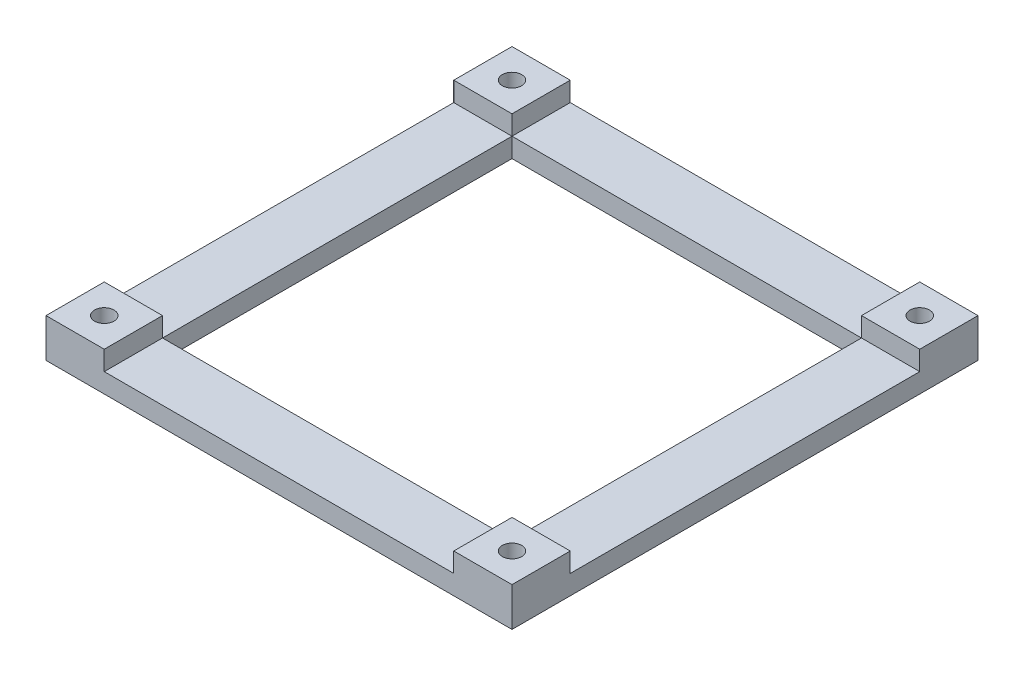
from build123d import *

# Parameters (mm, degrees)
SKETCH2_W           = 120
SKETCH2_H           = 120
SKETCH2_W_2         = 90
SKETCH2_H_2         = 90
BOSS_EXTRUDE1_DEPTH = 5
SKETCH3_W           = 15
SKETCH3_H           = 15
BOSS_EXTRUDE2_DEPTH = 5
SKETCH4_R           = 2.5
CUT_EXTRUDE1_DEPTH  = 86.440037453


with BuildPart() as part:
    # Sketch2 → Boss-Extrude1 (new body)
    with BuildSketch(Plane(origin=(0, 0, 0), x_dir=(1, 0, 0), z_dir=(0, 1, 0))):
        Rectangle(SKETCH2_W, SKETCH2_H)
        Rectangle(SKETCH2_W_2, SKETCH2_H_2, mode=Mode.SUBTRACT)
    extrude(amount=BOSS_EXTRUDE1_DEPTH)

    # Sketch3 → Boss-Extrude2 (add)
    with BuildSketch(Plane(origin=(0, 5, 0), x_dir=(1, 0, 0), z_dir=(0, 1, 0))):
        with Locations((52.5, 52.5)):
            Rectangle(SKETCH3_W, SKETCH3_H)
        with Locations((-52.5, 52.5)):
            Rectangle(SKETCH3_W, SKETCH3_H)
        with Locations((52.5, -52.5)):
            Rectangle(SKETCH3_W, SKETCH3_H)
        with Locations((-52.5, -52.5)):
            Rectangle(SKETCH3_W, SKETCH3_H)
    extrude(amount=BOSS_EXTRUDE2_DEPTH)

    # Sketch4 → Cut-Extrude1 (cut, through all)
    with BuildSketch(Plane(origin=(0, 10, 0), x_dir=(1, 0, 0), z_dir=(0, 1, 0))):
        with Locations(Location((-52.5, -52.5, 0), (0, 0, 270))):
            Circle(SKETCH4_R)
        with Locations(Location((-52.5, 52.5, 0), (0, 0, 270))):
            Circle(SKETCH4_R)
        with Locations(Location((52.5, 52.5, 0), (0, 0, 270))):
            Circle(SKETCH4_R)
        with Locations(Location((52.5, -52.5, 0), (0, 0, 270))):
            Circle(SKETCH4_R)
    extrude(amount=-CUT_EXTRUDE1_DEPTH, mode=Mode.SUBTRACT)


solid = part.part
